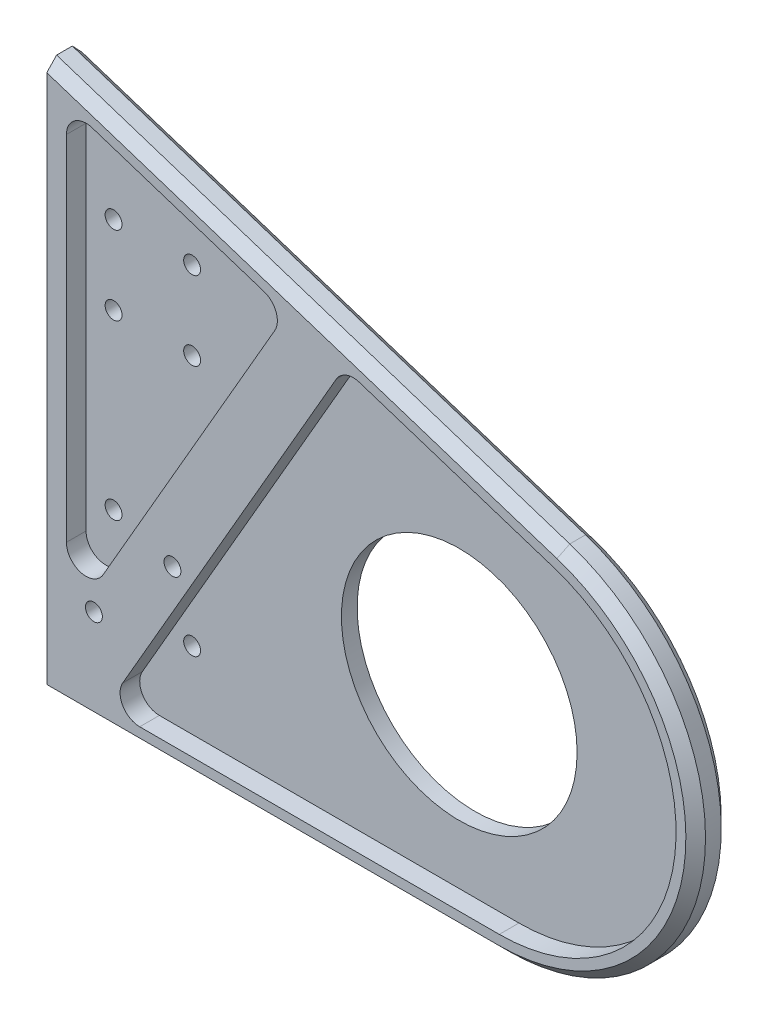
from build123d import *

# Parameters (mm, degrees)
SKETCH_1_R               = 60
EXTRUDE_1_DEPTH          = 8
FILLET_1_R               = 100
EXTRUDE_START            = 10
EXTRUDE_2_DEPTH          = 10
FILLET_2_R               = 10
CHAMFER_1_SIZE           = 5
CUT_EXTRUDE_1_DEPTH      = 434.442567426
CUT_EXTRUDE_1_DEPTH_BACK = 434.442567426
SKETCH_3_R               = 4.3


with BuildPart() as part:
    # 草图1 → 凸台-拉伸1 (new body)
    with BuildSketch(Plane.XY):
        Polygon((0, 0), (0, 280), (861.751390409, 0), align=None)
        with Locations((200, 100)):
            Circle(SKETCH_1_R, mode=Mode.SUBTRACT)
    extrude(amount=EXTRUDE_1_DEPTH)

    # 圆角1
    fillet_1_edges = [part.edges().sort_by_distance(p)[0] for p in [
        (861.751390409, 0, 4),
    ]]
    fillet(fillet_1_edges, radius=FILLET_1_R)

    # 草图2 → 凸台-拉伸2 (add)
    with BuildSketch(Plane.XY.offset(8).offset(EXTRUDE_START)):
        with BuildLine():
            Line((0, 0), (230.376238942, 0))
            ThreePointArc((230.376238942, 0), (329.145073001, 84.356553496), (261.277938379, 195.10565163))
            Line((261.277938379, 195.10565163), (0, 280))
            Line((0, 280), (0, 0))
        make_face()
        Polygon((10, 266.236180795), (10, 35.358983849), (122.241374643, 229.766747442), align=None, mode=Mode.SUBTRACT)
        with BuildLine():
            Line((30, 10), (230.376238942, 10))
            ThreePointArc((230.376238942, 10), (319.268189595, 85.920898146), (258.187768435, 185.595086467))
            Line((258.187768435, 185.595086467), (151.410485182, 220.289128906))
            Line((151.410485182, 220.289128906), (30, 10))
        make_face(mode=Mode.SUBTRACT)
    extrude(amount=-EXTRUDE_2_DEPTH)

    # 圆角2
    fillet_2_edges = [part.edges().sort_by_distance(p)[0] for p in [
        (10, 266.236180795, 13),
        (10, 35.358983849, 13),
        (122.241374643, 229.766747442, 13),
        (30, 10, 13),
        (151.410485182, 220.289128906, 13),
    ]]
    fillet(fillet_2_edges, radius=FILLET_2_R)

    # 倒角1
    chamfer_1_edges = [part.edges().sort_by_distance(p)[0] for p in [
        (130.63896919, 237.552825815, 0),
        (329.145073001, 84.356553496, 0),
        (115.188119471, 0, 18),
        (329.145073001, 84.356553496, 18),
        (130.63896919, 237.552825815, 18),
        (115.188119471, 0, 0),
    ]]
    chamfer(chamfer_1_edges, length=CHAMFER_1_SIZE)

    # 草图3 → 切除-拉伸1 (cut, two sides: drawn at the far end of the back side and taken through both)
    with BuildSketch(Plane(origin=(0, 0, 0), x_dir=(-1, 0, 0), z_dir=(0, 0, -1)).offset(-CUT_EXTRUDE_1_DEPTH_BACK)):
        with Locations((-64, 217)):
            Circle(SKETCH_3_R)
        with Locations((-64, 177)):
            Circle(SKETCH_3_R)
        with Locations((-24, 217)):
            Circle(SKETCH_3_R)
        with Locations((-24, 177)):
            Circle(SKETCH_3_R)
        with Locations((-64, 89)):
            Circle(SKETCH_3_R)
        with Locations((-24, 89)):
            Circle(SKETCH_3_R)
        with Locations((-64, 49)):
            Circle(SKETCH_3_R)
        with Locations((-24, 49)):
            Circle(SKETCH_3_R)
    extrude(amount=CUT_EXTRUDE_1_DEPTH + CUT_EXTRUDE_1_DEPTH_BACK, mode=Mode.SUBTRACT)


solid = part.part
